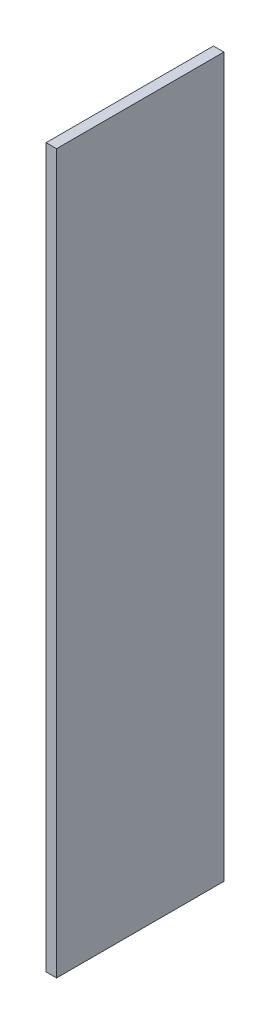
from build123d import *

# Parameters (mm, degrees)
SKETCH1_W           = 48
SKETCH1_H           = 206
BOSS_EXTRUDE1_DEPTH = 3


with BuildPart() as part:
    # Sketch1 → Boss-Extrude1 (new body)
    with BuildSketch(Plane(origin=(0, 0, 0), x_dir=(0, 0, -1), z_dir=(1, 0, 0))):
        Rectangle(SKETCH1_W, SKETCH1_H)
    extrude(amount=BOSS_EXTRUDE1_DEPTH)


solid = part.part
